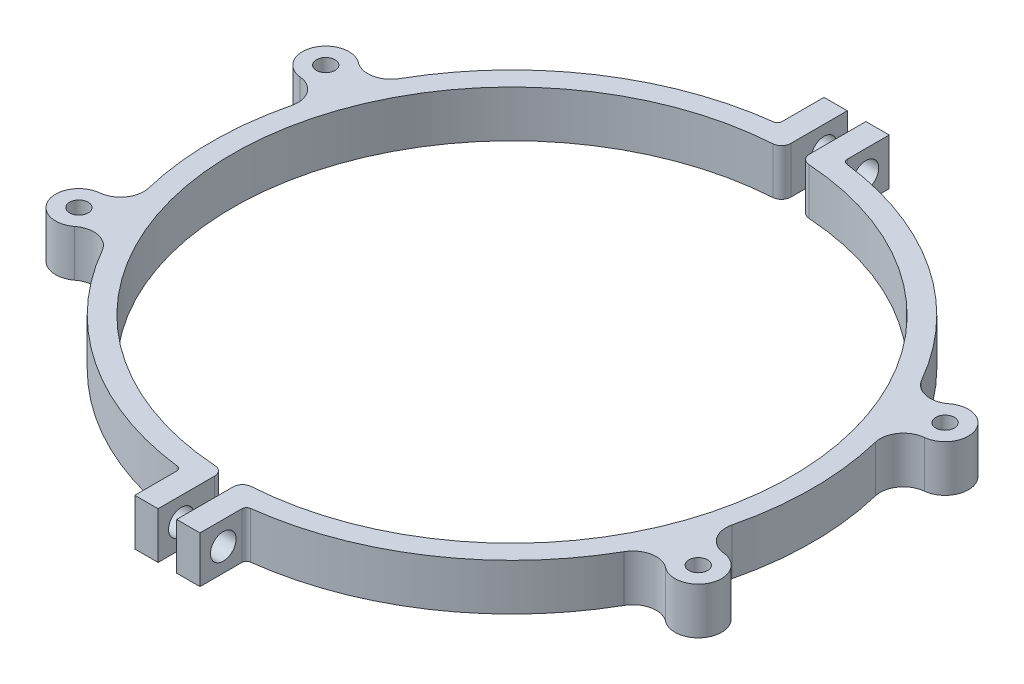
from build123d import *

# Parameters (mm, degrees)
EXTRUDE_1_DEPTH                = 5
EXTRUDE_1_2_DEPTH              = 5
CUT_EXTRUDE_1_DEPTH            = 104.020629002
CUT_EXTRUDE_1_DEPTH_BACK       = 104.020629002
SKETCH_2_R                     = 2.75
SKETCH_4_W                     = 2
SKETCH_4_H                     = 10
HOLE_WIZARD_4_0_4_1_AT_2_COUNT = 2
HOLE_WIZARD_4_0_4_1_AT_2_PITCH = 53
HOLE_WIZARD_4_0_4_1_AT_3_COUNT = 2
HOLE_WIZARD_4_0_4_1_AT_3_PITCH = 143.171226159
HOLE_WIZARD_4_0_4_1_AT_4_COUNT = 2
HOLE_WIZARD_4_0_4_1_AT_4_PITCH = 133


with BuildPart() as part:
    # 草图1 → 凸台-拉伸1 (new, symmetric)
    with BuildSketch(Plane(origin=(0, 0, 0), x_dir=(1, 0, 0), z_dir=(0, 1, 0))):
        with BuildLine():
            Line((-7, 65.009614674), (-7, 74))
            Line((-7, 74), (-2, 74))
            Line((-2, 74), (-2, 61.870833193))
            ThreePointArc((-2, 61.870833193), (-2.540879629, 60.502999964), (-3.870967742, 59.874999864))
            ThreePointArc((-3.870967742, 59.874999864), (-60, 0), (-3.870967742, -59.874999864))
            ThreePointArc((-3.870967742, -59.874999864), (-2.540879629, -60.502999964), (-2, -61.870833193))
            Line((-2, -61.870833193), (-2, -74))
            Line((-2, -74), (-7, -74))
            Line((-7, -74), (-7, -65.009614674))
            ThreePointArc((-7, -65.009614674), (-7.250954806, -64.34709577), (-7.877862595, -64.017101472))
            ThreePointArc((-7.877862595, -64.017101472), (-35.758246425, -53.680516136), (-56.039077408, -31.935431784))
            ThreePointArc((-56.039077408, -31.935431784), (-59.402990359, -29.508067468), (-63.441595968, -30.455523325))
            ThreePointArc((-63.441595968, -30.455523325), (-71.144788047, -28.350930575), (-67.000337391, -21.525096735))
            ThreePointArc((-67.000337391, -21.525096735), (-63.416978813, -19.435228518), (-62.644511129, -15.35953207))
            ThreePointArc((-62.644511129, -15.35953207), (-64.5, 0), (-62.644511129, 15.35953207))
            ThreePointArc((-62.644511129, 15.35953207), (-63.416978813, 19.435228518), (-67.000337391, 21.525096735))
            ThreePointArc((-67.000337391, 21.525096735), (-71.144788047, 28.350930575), (-63.441595968, 30.455523325))
            ThreePointArc((-63.441595968, 30.455523325), (-59.402990359, 29.508067468), (-56.039077408, 31.935431784))
            ThreePointArc((-56.039077408, 31.935431784), (-35.758246425, 53.680516136), (-7.877862595, 64.017101472))
            ThreePointArc((-7.877862595, 64.017101472), (-7.250954806, 64.34709577), (-7, 65.009614674))
        make_face()
    extrude(amount=EXTRUDE_1_DEPTH, both=True)


with BuildPart() as body_2:
    # 草图1 → Extrude 1 2 (new, symmetric)
    with BuildSketch(Plane(origin=(0, 0, 0), x_dir=(1, 0, 0), z_dir=(0, 1, 0))):
        with BuildLine():
            Line((2, 74), (2, 61.870833193))
            ThreePointArc((2, 61.870833193), (2.540879629, 60.502999964), (3.870967742, 59.874999864))
            ThreePointArc((3.870967742, 59.874999864), (60, 0), (3.870967742, -59.874999864))
            ThreePointArc((3.870967742, -59.874999864), (2.540879629, -60.502999964), (2, -61.870833193))
            Line((2, -61.870833193), (2, -74))
            Line((2, -74), (7, -74))
            Line((7, -74), (7, -65.009614674))
            ThreePointArc((7, -65.009614674), (7.250954806, -64.34709577), (7.877862595, -64.017101472))
            ThreePointArc((7.877862595, -64.017101472), (35.758246425, -53.680516136), (56.039077408, -31.935431784))
            ThreePointArc((56.039077408, -31.935431784), (59.402990359, -29.508067468), (63.441595968, -30.455523325))
            ThreePointArc((63.441595968, -30.455523325), (71.144788047, -28.350930575), (67.000337391, -21.525096735))
            ThreePointArc((67.000337391, -21.525096735), (63.416978813, -19.435228518), (62.644511129, -15.35953207))
            ThreePointArc((62.644511129, -15.35953207), (64.5, 0), (62.644511129, 15.35953207))
            ThreePointArc((62.644511129, 15.35953207), (63.416978813, 19.435228518), (67.000337391, 21.525096735))
            ThreePointArc((67.000337391, 21.525096735), (71.144788047, 28.350930575), (63.441595968, 30.455523325))
            ThreePointArc((63.441595968, 30.455523325), (59.402990359, 29.508067468), (56.039077408, 31.935431784))
            ThreePointArc((56.039077408, 31.935431784), (35.758246425, 53.680516136), (7.877862595, 64.017101472))
            ThreePointArc((7.877862595, 64.017101472), (7.250954806, 64.34709577), (7, 65.009614674))
            Line((7, 65.009614674), (7, 74))
            Line((7, 74), (2, 74))
        make_face()
    extrude(amount=EXTRUDE_1_2_DEPTH, both=True)


with BuildPart() as cut_extrude_1_tool:
    # 草图2 → 切除-拉伸1 (new, two sides: drawn at the far end of the back side and taken through both)
    with BuildSketch(Plane(origin=(0, 0, 0), x_dir=(0, 0, -1), z_dir=(1, 0, 0)).offset(-CUT_EXTRUDE_1_DEPTH_BACK)):
        with Locations((-69, 0)):
            Circle(SKETCH_2_R)
        with Locations((69, 0)):
            Circle(SKETCH_2_R)
    extrude(amount=CUT_EXTRUDE_1_DEPTH + CUT_EXTRUDE_1_DEPTH_BACK)


with BuildPart() as part_1:
    add(part.part)

    # 切除-拉伸1: cut by cut_extrude_1_tool
    add(cut_extrude_1_tool.part, mode=Mode.SUBTRACT)

    # 草图4 → Ø4.0 (4) 直径孔1 (revolve, cut)
    with BuildSketch(Plane(origin=(-66.5, 5, -26.5), x_dir=(0, 0, 1), z_dir=(1, 0, 0))):
        with Locations((1, 5)):
            Rectangle(SKETCH_4_W, SKETCH_4_H)
    hole_wizard_4_0_4_1 = revolve(axis=Axis((-66.5, 11.35, -26.5), (0, -1, 0)), mode=Mode.SUBTRACT)

    # Ø4.0 (4) 直径孔1 at 2: Ø4.0 (4) 直径孔1 ×2
    with Locations(*[(0, 0, i * HOLE_WIZARD_4_0_4_1_AT_2_PITCH) for i in range(1, HOLE_WIZARD_4_0_4_1_AT_2_COUNT)]):
        add(hole_wizard_4_0_4_1, mode=Mode.SUBTRACT)


with BuildPart() as body_2_1:
    add(body_2.part)

    # 切除-拉伸1: cut by cut_extrude_1_tool
    add(cut_extrude_1_tool.part, mode=Mode.SUBTRACT)

    # Ø4.0 (4) 直径孔1 at 3: Ø4.0 (4) 直径孔1 ×2
    with Locations(*[Vector(0.9289576094841776, 0, 0.37018611505760474) * (i * HOLE_WIZARD_4_0_4_1_AT_3_PITCH) for i in range(1, HOLE_WIZARD_4_0_4_1_AT_3_COUNT)]):
        add(hole_wizard_4_0_4_1, mode=Mode.SUBTRACT)

    # Ø4.0 (4) 直径孔1 at 4: Ø4.0 (4) 直径孔1 ×2
    with Locations(*[(i * HOLE_WIZARD_4_0_4_1_AT_4_PITCH, 0, 0) for i in range(1, HOLE_WIZARD_4_0_4_1_AT_4_COUNT)]):
        add(hole_wizard_4_0_4_1, mode=Mode.SUBTRACT)


solid = Compound([part_1.part, body_2_1.part])
